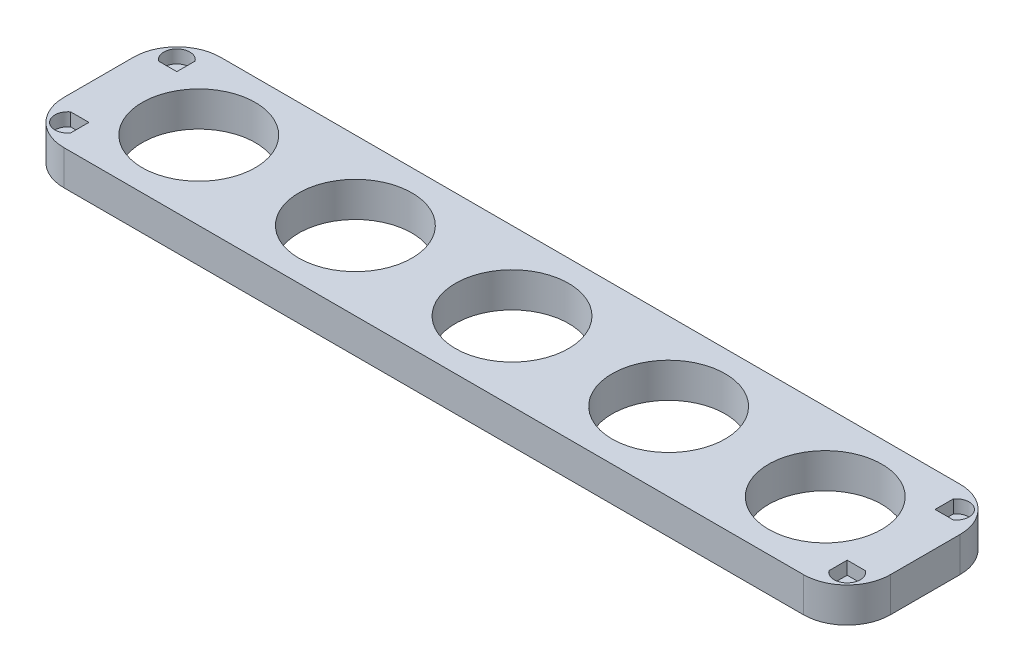
from build123d import *

# Parameters (mm, degrees)
SKETCH5_W           = 190
SKETCH5_H           = 36
BOSS_EXTRUDE1_DEPTH = 8
SKETCH6_R           = 13
SKETCH6_R_2         = 12.99768992
CUT_EXTRUDE1_DEPTH  = 8
FILLET2_R           = 10
CUT_EXTRUDE2_DEPTH  = 3


with BuildPart() as part:
    # Sketch5 → Boss-Extrude1 (new body)
    with BuildSketch(Plane(origin=(0, 0, 0), x_dir=(1, 0, 0), z_dir=(0, 1, 0))):
        with Locations((95, 18)):
            Rectangle(SKETCH5_W, SKETCH5_H)
    extrude(amount=BOSS_EXTRUDE1_DEPTH)

    # Sketch6 → Cut-Extrude1 (cut)
    with BuildSketch(Plane(origin=(0, 8, 0), x_dir=(1, 0, 0), z_dir=(0, 1, 0))):
        with Locations(Location((23, 18, 0), (0, 0, 270))):
            Circle(SKETCH6_R)
        with Locations(Location((59, 18, 0), (0, 0, 270))):
            Circle(SKETCH6_R)
        with Locations(Location((95.004620161, 18, 0), (0, 0, 270))):
            Circle(SKETCH6_R)
        with Locations(Location((131.004620161, 18, 0), (0, 0, 270))):
            Circle(SKETCH6_R)
        with Locations(Location((167.00231008, 18, 0), (0, 0, 270))):
            Circle(SKETCH6_R_2)
    extrude(amount=-CUT_EXTRUDE1_DEPTH, mode=Mode.SUBTRACT)

    # Fillet2
    fillet2_edges = [part.edges().sort_by_distance(p)[0] for p in [
        (0, 4, -36),
        (190, 4, -36),
        (190, 4, 0),
        (0, 4, 0),
    ]]
    fillet(fillet2_edges, radius=FILLET2_R)

    # Sketch7 → Cut-Extrude2 (cut)
    with BuildSketch(Plane(origin=(0, 8, 0), x_dir=(1, 0, 0), z_dir=(0, 1, 0))):
        with BuildLine():
            Line((3.652564445, 28.100196169), (7.852564445, 28.100196169))
            Line((7.852564445, 28.100196169), (7.852564445, 32.300196169))
            ThreePointArc((7.852564445, 32.300196169), (3.324368465, 32.628392149), (3.652564445, 28.100196169))
        make_face()
        with BuildLine():
            Line((3.652564445, 7.899803831), (7.852564445, 7.899803831))
            Line((7.852564445, 7.899803831), (7.852564445, 3.699803831))
            ThreePointArc((7.852564445, 3.699803831), (3.324368465, 3.371607851), (3.652564445, 7.899803831))
        make_face()
        with BuildLine():
            Line((186.347435555, 28.100196169), (182.147435555, 28.100196169))
            Line((182.147435555, 28.100196169), (182.147435555, 32.300196169))
            ThreePointArc((182.147435555, 32.300196169), (186.675631535, 32.628392149), (186.347435555, 28.100196169))
        make_face()
        with BuildLine():
            Line((182.147435555, 7.899803831), (182.147435555, 3.699803831))
            ThreePointArc((182.147435555, 3.699803831), (186.675631535, 3.371607851), (186.347435555, 7.899803831))
            Line((186.347435555, 7.899803831), (182.147435555, 7.899803831))
        make_face()
    extrude(amount=-CUT_EXTRUDE2_DEPTH, mode=Mode.SUBTRACT)


solid = part.part
